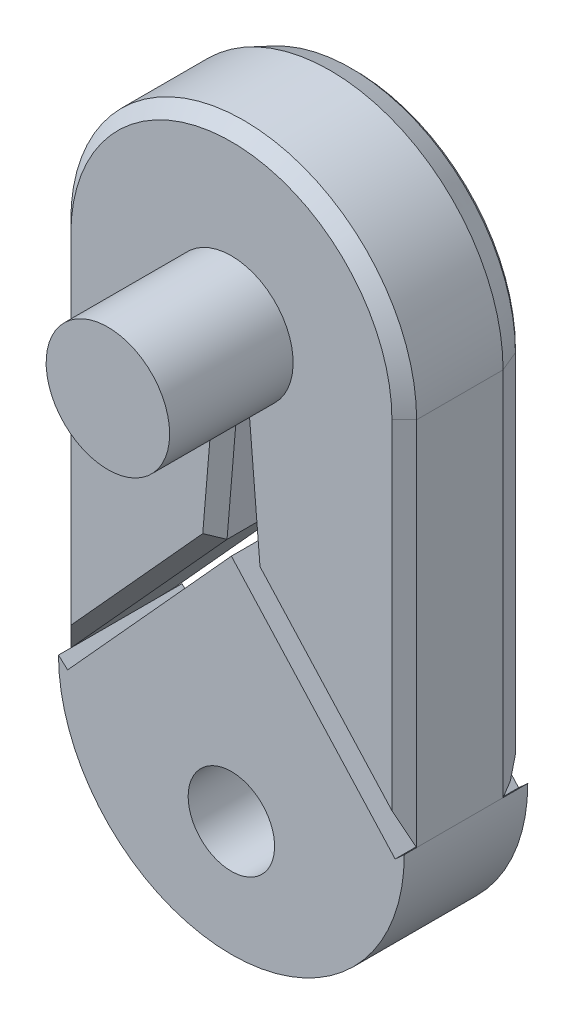
from build123d import *

# Parameters (mm, degrees)
BOSS_EXTRUDE1_DEPTH = 10
SKETCH2_R           = 5
BOSS_EXTRUDE2_DEPTH = 10
CUT_EXTRUDE10_DEPTH = 15
CHAMFER1_SIZE       = 1
CHAMFER2_SIZE       = 1
CHAMFER3_SIZE       = 1
CHAMFER4_SIZE       = 1
CHAMFER5_SIZE       = 1
SKETCH3_R           = 3.5
CUT_EXTRUDE11_DEPTH = 10


with BuildPart() as part:
    # Sketch1 → Boss-Extrude1 (new body)
    with BuildSketch(Plane.XY):
        with BuildLine():
            Line((14, 0), (14, -30))
            ThreePointArc((14, -30), (0, -44), (-14, -30))
            Line((-14, -30), (-14, 0))
            ThreePointArc((-14, 0), (0, 14), (14, 0))
        make_face()
    extrude(amount=BOSS_EXTRUDE1_DEPTH)

    # Sketch2 → Boss-Extrude2 (add)
    with BuildSketch(Plane.XY.offset(10)):
        Circle(SKETCH2_R)
    extrude(amount=BOSS_EXTRUDE2_DEPTH)

    # Sketch5 → Cut-Extrude10 (cut)
    with BuildSketch(Plane(origin=(0, 0, 0), x_dir=(-1, 0, 0), z_dir=(0, 0, -1))):
        Polygon((-14, -30), (-1.350424067, -16.061825706), (0, 0), (1.350424067, -16.061825706), (14, -30), (13.25949187, -30.672047401), (0, -16.061825706), (-13.25949187, -30.672047401), align=None)
    extrude(amount=-CUT_EXTRUDE10_DEPTH, mode=Mode.SUBTRACT)


with BuildPart() as cut_extrude10_piece_1:
    # of the separate pieces the step leaves, piece 1, a body of its own (cut_extrude10_pieces)
    add(part.part.solids().sort_by_distance((-14, 0, 0))[0])

    # Chamfer1
    chamfer1_edges = [cut_extrude10_piece_1.edges().sort_by_distance(p)[0] for p in [
        (0, 14, 10),
        (-14, -15, 10),
        (14, -15, 10),
    ]]
    chamfer(chamfer1_edges, length=CHAMFER1_SIZE)

    # Chamfer2
    chamfer2_edges = [cut_extrude10_piece_1.edges().sort_by_distance(p)[0] for p in [
        (0, 14, 0),
        (-14, -15, 0),
        (14, -15, 0),
    ]]
    chamfer(chamfer2_edges, length=CHAMFER2_SIZE)

    # Chamfer3
    chamfer3_edges = [cut_extrude10_piece_1.edges().sort_by_distance(p)[0] for p in [
        (-7.175212033, -22.479978404, 0),
        (7.175212033, -22.479978404, 0),
        (0.675212033, -8.030912853, 0),
        (-0.675212033, -8.030912853, 0),
    ]]
    chamfer(chamfer3_edges, length=CHAMFER3_SIZE)

    # Chamfer4
    chamfer4_edges = [cut_extrude10_piece_1.edges().sort_by_distance(p)[0] for p in [
        (-7.175212033, -22.479978404, 10),
        (-0.884664598, -10.522123326, 10),
        (7.175212033, -22.479978404, 10),
        (0.884664598, -10.522123326, 10),
    ]]
    chamfer(chamfer4_edges, length=CHAMFER4_SIZE)

    # Chamfer5
    chamfer5_edges = [cut_extrude10_piece_1.edges().sort_by_distance(p)[0] for p in [
        (-14, -15, 1),
        (0, 14, 1),
        (14, -15, 1),
    ]]
    chamfer(chamfer5_edges, length=CHAMFER5_SIZE)


with BuildPart() as cut_extrude10_piece_2:
    # of the separate pieces the step leaves, piece 2, a body of its own (cut_extrude10_pieces)
    add(part.part.solids().sort_by_distance((13.25949187, -30.672047401, 0))[0])

    # Sketch3 → Cut-Extrude11 (cut)
    with BuildSketch(Plane(origin=(0, 0, 0), x_dir=(-1, 0, 0), z_dir=(0, 0, -1))):
        with Locations((0, -34.664450994)):
            Circle(SKETCH3_R)
    extrude(amount=-CUT_EXTRUDE11_DEPTH, mode=Mode.SUBTRACT)


solid = Compound([cut_extrude10_piece_1.part, cut_extrude10_piece_2.part])
